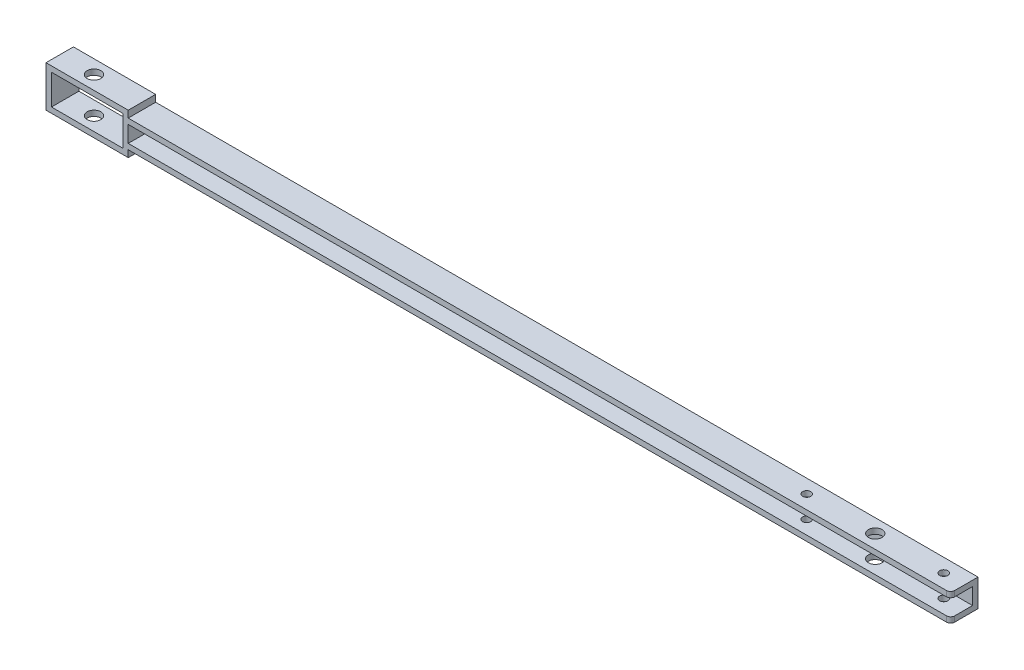
from build123d import *

# Parameters (mm, degrees)
SKETCH1_W           = 30
SKETCH1_H           = 15
SKETCH1_W_2         = 26
SKETCH1_H_2         = 11
BOSS_EXTRUDE1_DEPTH = 10
SKETCH3_R           = 2.5
CUT_EXTRUDE1_DEPTH  = 100
SKETCH5_W           = 300
SKETCH5_H           = 10
BOSS_EXTRUDE2_DEPTH = 10
SKETCH6_W           = 8
SKETCH6_H           = 6
CUT_EXTRUDE2_DEPTH  = 300
SKETCH7_R           = 1.5
SKETCH7_R_2         = 2.5
CUT_EXTRUDE3_DEPTH  = 300
FILLET1_R           = 1.5
SKETCH8_W           = 15
SKETCH8_H           = 6
CUT_EXTRUDE4_DEPTH  = 0.5
SKETCH11_W          = 15
SKETCH11_H          = 6
CUT_EXTRUDE8_DEPTH  = 1
SKETCH9_W           = 15
SKETCH9_H           = 6
CUT_EXTRUDE5_DEPTH  = 0.5


with BuildPart() as part:
    # Sketch1 → Boss-Extrude1 (new body)
    with BuildSketch(Plane.XY):
        with Locations((15, 7.5)):
            Rectangle(SKETCH1_W, SKETCH1_H)
        with Locations((15, 7.5)):
            Rectangle(SKETCH1_W_2, SKETCH1_H_2, mode=Mode.SUBTRACT)
    extrude(amount=BOSS_EXTRUDE1_DEPTH)

    # Sketch3 → Cut-Extrude1 (cut)
    with BuildSketch(Plane(origin=(0, 15, 0), x_dir=(1, 0, 0), z_dir=(0, 1, 0))):
        with Locations(Location((12.5, -5, 0), (0, 0, 270))):
            Circle(SKETCH3_R)
    extrude(amount=-CUT_EXTRUDE1_DEPTH, mode=Mode.SUBTRACT)

    # Sketch5 → Boss-Extrude2 (add)
    with BuildSketch(Plane(origin=(0, 0, 0), x_dir=(-1, 0, 0), z_dir=(0, 0, -1))):
        with Locations((-180, 7.5)):
            Rectangle(SKETCH5_W, SKETCH5_H)
    extrude(amount=-BOSS_EXTRUDE2_DEPTH)

    # Sketch6 → Cut-Extrude2 (cut)
    with BuildSketch(Plane(origin=(330, 0, 0), x_dir=(0, 0, -1), z_dir=(1, 0, 0))):
        with Locations((-6, 7.5)):
            Rectangle(SKETCH6_W, SKETCH6_H)
    extrude(amount=-CUT_EXTRUDE2_DEPTH, mode=Mode.SUBTRACT)

    # Sketch7 → Cut-Extrude3 (cut)
    with BuildSketch(Plane(origin=(0, 2.5, 0), x_dir=(-1, 0, 0), z_dir=(0, -1, 0))):
        with Locations(Location((-272.5, -5, 0), (0, 0, 90))):
            Circle(SKETCH7_R)
        with Locations(Location((-297.5, -5, 0), (0, 0, 90))):
            Circle(SKETCH7_R_2)
        with Locations(Location((-322.5, -5, 0), (0, 0, 90))):
            Circle(SKETCH7_R)
    extrude(amount=-CUT_EXTRUDE3_DEPTH, mode=Mode.SUBTRACT)

    # Fillet1
    fillet1_edges = [part.edges().sort_by_distance(p)[0] for p in [
        (330, 11.5, 10),
        (330, 3.5, 10),
    ]]
    fillet(fillet1_edges, radius=FILLET1_R)

    # Sketch8 → Cut-Extrude4 (cut)
    with BuildSketch(Plane.XY.offset(2)):
        with Locations((49.047215434, 7.5)):
            Rectangle(SKETCH8_W, SKETCH8_H)
    extrude(amount=-CUT_EXTRUDE4_DEPTH, mode=Mode.SUBTRACT)

    # Sketch11 → Cut-Extrude8 (cut)
    with BuildSketch(Plane.XY.offset(2)):
        with Locations((254.956595829, 7.5)):
            Rectangle(SKETCH11_W, SKETCH11_H)
    extrude(amount=-CUT_EXTRUDE8_DEPTH, mode=Mode.SUBTRACT)

    # Sketch9 → Cut-Extrude5 (cut)
    with BuildSketch(Plane.XY.offset(2)):
        with Locations((308.27436269, 7.5)):
            Rectangle(SKETCH9_W, SKETCH9_H)
    extrude(amount=-CUT_EXTRUDE5_DEPTH, mode=Mode.SUBTRACT)


solid = part.part
